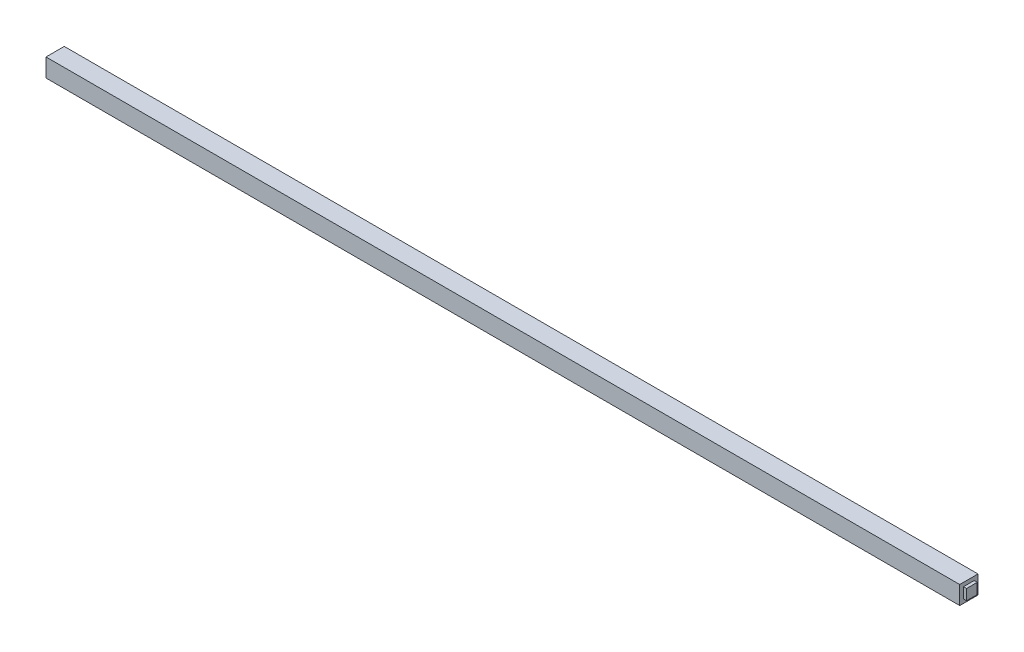
from build123d import *

# Parameters (mm, degrees)
SKETCH1_W           = 300
SKETCH1_H           = 6
BOSS_EXTRUDE1_DEPTH = 6
SKETCH3_W           = 3.5
SKETCH3_H           = 3.5
BOSS_EXTRUDE2_DEPTH = 1


with BuildPart() as part:
    # Sketch1 → Boss-Extrude1 (new body)
    with BuildSketch(Plane(origin=(0, 0, 0), x_dir=(1, 0, 0), z_dir=(0, 1, 0))):
        with Locations((150, 3)):
            Rectangle(SKETCH1_W, SKETCH1_H)
    extrude(amount=BOSS_EXTRUDE1_DEPTH)

    # Sketch3 → Boss-Extrude2 (add)
    with BuildSketch(Plane(origin=(300, 0, 0), x_dir=(0, 0, -1), z_dir=(1, 0, 0))):
        with Locations((3, 3)):
            Rectangle(SKETCH3_W, SKETCH3_H)
    boss_extrude2 = extrude(amount=BOSS_EXTRUDE2_DEPTH)

    # Mirror1: Boss-Extrude2 across plane
    add(boss_extrude2.mirror(Plane(origin=(150, 0, 0), x_dir=(0, 0, 1), z_dir=(1, 0, 0))))


solid = part.part
